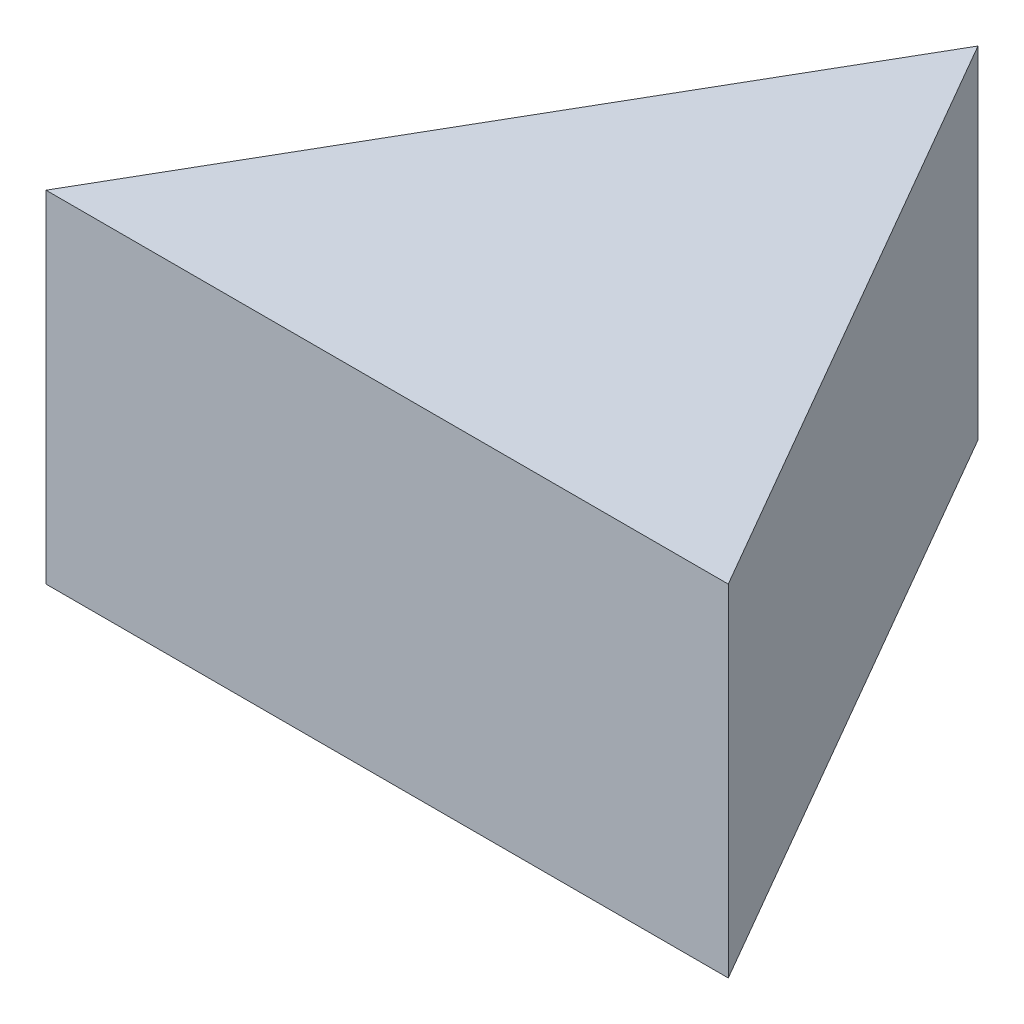
from build123d import *

# Parameters (mm, degrees)
BOSS_EXTRUDE1_DEPTH = 20


with BuildPart() as part:
    # Sketch1 → Boss-Extrude1 (new body)
    with BuildSketch(Plane(origin=(0, 0, 0), x_dir=(1, 0, 0), z_dir=(0, 1, 0))):
        Polygon((0, 34.641016151), (-20, 0), (0, 0), align=None)
        Polygon((0, 34.641016151), (0, 0), (20, 0), align=None)
    extrude(amount=BOSS_EXTRUDE1_DEPTH)


solid = part.part
